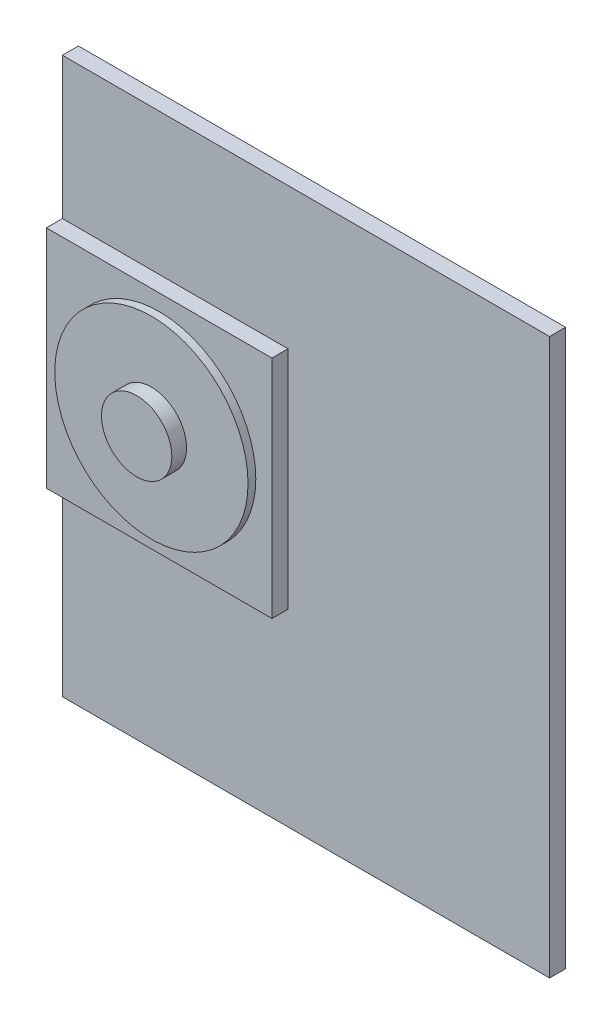
from build123d import *

# Parameters (mm, degrees)
SKETCH1_W           = 95.7
SKETCH1_H           = 95.7
BOSS_EXTRUDE1_DEPTH = 6.8
SKETCH2_W           = 206.7
SKETCH2_H           = 235.7
BOSS_EXTRUDE2_DEPTH = 6.8
SKETCH3_R           = 41
BOSS_EXTRUDE3_DEPTH = 3.3
SKETCH4_R           = 14.925
BOSS_EXTRUDE4_DEPTH = 6.25


with BuildPart() as part:
    # Sketch1 → Boss-Extrude1 (new body)
    with BuildSketch(Plane.XY):
        Rectangle(SKETCH1_W, SKETCH1_H)
    extrude(amount=BOSS_EXTRUDE1_DEPTH)

    # Sketch2 → Boss-Extrude2 (add)
    with BuildSketch(Plane.XY):
        with Locations((55.5, -10)):
            Rectangle(SKETCH2_W, SKETCH2_H)
    extrude(amount=-BOSS_EXTRUDE2_DEPTH)

    # Sketch3 → Boss-Extrude3 (add)
    with BuildSketch(Plane.XY.offset(6.8)):
        Circle(SKETCH3_R)
    extrude(amount=BOSS_EXTRUDE3_DEPTH)

    # Sketch4 → Boss-Extrude4 (add)
    with BuildSketch(Plane.XY.offset(10.1)):
        Circle(SKETCH4_R)
    extrude(amount=BOSS_EXTRUDE4_DEPTH)


solid = part.part
